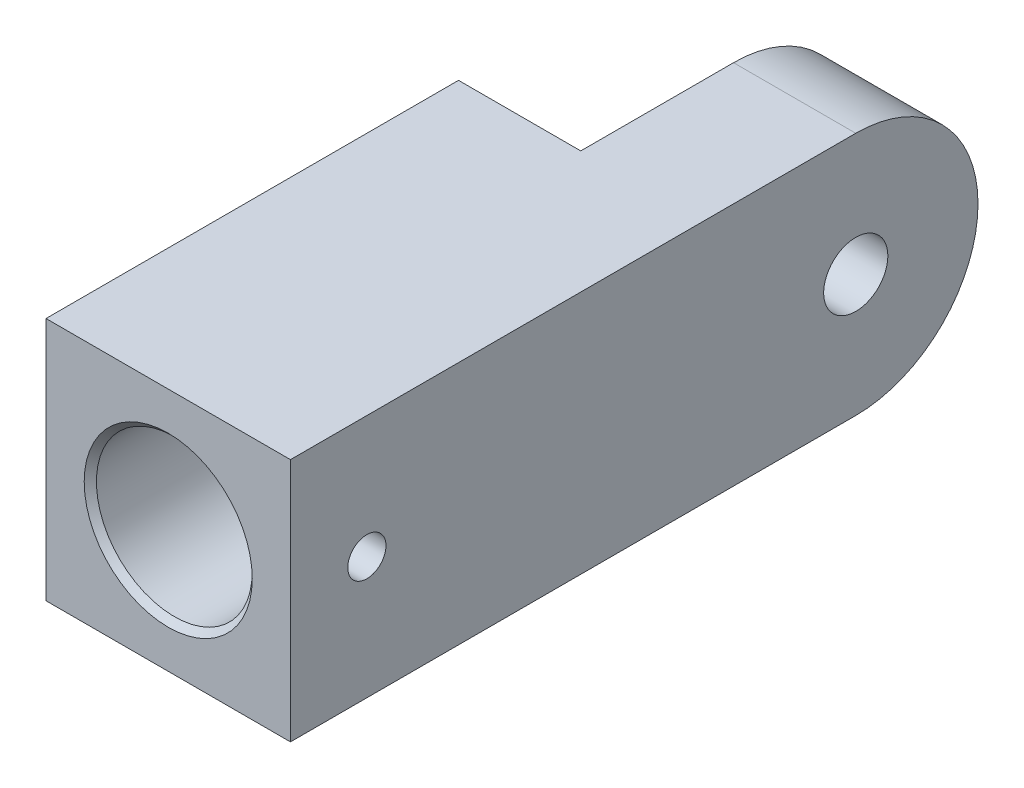
from build123d import *

# Parameters (mm, degrees)
SKETCH1_W                               = 16
SKETCH1_H                               = 16
BASE_DEPTH                              = 45
SKETCH3_R                               = 8
SLOTFORANOTHERPART_DEPTH                = 47.400431032
CHAMFERFORSLOT_DEPTH                    = 47.400431032
M5X0_8_TAPPED_HOLE_FOR_SLOTSCREW_D      = 4.2
M5X0_8_TAPPED_HOLE_FOR_SLOTSCREW_DEPTH  = 11.1381927
M5X0_8_TAPPED_HOLE_FOR_SLOTSCREW_TIP    = 1.2618073
M3X0_5_TAPPED_HOLE_FOR_ROD_FIXING_D     = 2.5
M3X0_5_TAPPED_HOLE_FOR_ROD_FIXING_DEPTH = 6.748924226
M3X0_5_TAPPED_HOLE_FOR_ROD_FIXING_TIP   = 0.751075774
F_10_2_10_2_ROD_HOLE_D                  = 10.2
F_10_2_10_2_ROD_HOLE_DEPTH              = 11.935610843
F_10_2_10_2_ROD_HOLE_CSINK_D            = 11
F_10_2_10_2_ROD_HOLE_CSINK_ANGLE        = 90
F_10_2_10_2_ROD_HOLE_TIP                = 3.064389157


with BuildPart() as part:
    # Sketch1 → Base (new body)
    with BuildSketch(Plane.XY):
        Rectangle(SKETCH1_W, SKETCH1_H)
    extrude(amount=BASE_DEPTH)

    # Sketch3 → SlotForAnotherPart (cut, through all)
    with BuildSketch(Plane(origin=(0, 0, 0), x_dir=(0, 0, -1), z_dir=(1, 0, 0))):
        with BuildLine():
            Line((-8.000000039, 8), (-18, 8))
            Line((-18, 8), (-18, -8))
            Line((-18, -8), (-8, -8))
            ThreePointArc((-8, -8), (-16, -1.9e-08), (-8.000000039, 8))
        make_face()
        with Locations((-8, 0)):
            Circle(SKETCH3_R)
        with BuildLine():
            Line((1.927362357, 8), (-8.000000039, 8))
            ThreePointArc((-8.000000039, 8), (-2.343145764, 5.656854263), (0, 0))
            ThreePointArc((0, 0), (-2.343145751, -5.656854249), (-8, -8))
            Line((-8, -8), (1.927362357, -8))
            Line((1.927362357, -8), (1.927362357, 8))
        make_face()
    extrude(amount=-SLOTFORANOTHERPART_DEPTH, mode=Mode.SUBTRACT)

    # Sketch3<3> → ChamferForSlot (cut, through all)
    with BuildSketch(Plane(origin=(0, 0, 0), x_dir=(0, 0, -1), z_dir=(1, 0, 0))):
        with BuildLine():
            Line((1.927362357, 8), (-8.000000039, 8))
            ThreePointArc((-8.000000039, 8), (-2.343145764, 5.656854263), (0, 0))
            ThreePointArc((0, 0), (-2.343145751, -5.656854249), (-8, -8))
            Line((-8, -8), (1.927362357, -8))
            Line((1.927362357, -8), (1.927362357, 8))
        make_face()
    extrude(amount=CHAMFERFORSLOT_DEPTH, mode=Mode.SUBTRACT)

    # M5x0.8 Tapped Hole for SlotScrew
    with Locations(Plane(origin=(8, 0, 0), x_dir=(0, 0, -1), z_dir=(1, 0, 0))):
        with Locations((-8, 0)):
            Hole(M5X0_8_TAPPED_HOLE_FOR_SLOTSCREW_D / 2, depth=M5X0_8_TAPPED_HOLE_FOR_SLOTSCREW_DEPTH)
            with Locations((0, 0, -(M5X0_8_TAPPED_HOLE_FOR_SLOTSCREW_DEPTH + M5X0_8_TAPPED_HOLE_FOR_SLOTSCREW_TIP / 2))):  # 118° drill point
                Cone(0, M5X0_8_TAPPED_HOLE_FOR_SLOTSCREW_D / 2, M5X0_8_TAPPED_HOLE_FOR_SLOTSCREW_TIP, mode=Mode.SUBTRACT)

    # M3x0.5 Tapped Hole for Rod Fixing
    with Locations(Plane(origin=(8, 0, 0), x_dir=(0, 0, -1), z_dir=(1, 0, 0))):
        with Locations((-40, 0)):
            Hole(M3X0_5_TAPPED_HOLE_FOR_ROD_FIXING_D / 2, depth=M3X0_5_TAPPED_HOLE_FOR_ROD_FIXING_DEPTH)
            with Locations((0, 0, -(M3X0_5_TAPPED_HOLE_FOR_ROD_FIXING_DEPTH + M3X0_5_TAPPED_HOLE_FOR_ROD_FIXING_TIP / 2))):  # 118° drill point
                Cone(0, M3X0_5_TAPPED_HOLE_FOR_ROD_FIXING_D / 2, M3X0_5_TAPPED_HOLE_FOR_ROD_FIXING_TIP, mode=Mode.SUBTRACT)

    # Ø10.2 (10.2) Rod Hole
    with Locations(Plane.XY.offset(45)):
        with Locations((0, 0)):
            CounterSinkHole(F_10_2_10_2_ROD_HOLE_D / 2, F_10_2_10_2_ROD_HOLE_CSINK_D / 2, depth=F_10_2_10_2_ROD_HOLE_DEPTH, counter_sink_angle=F_10_2_10_2_ROD_HOLE_CSINK_ANGLE)
            with Locations((0, 0, -(F_10_2_10_2_ROD_HOLE_DEPTH + F_10_2_10_2_ROD_HOLE_TIP / 2))):  # 118° drill point
                Cone(0, F_10_2_10_2_ROD_HOLE_D / 2, F_10_2_10_2_ROD_HOLE_TIP, mode=Mode.SUBTRACT)


solid = part.part
